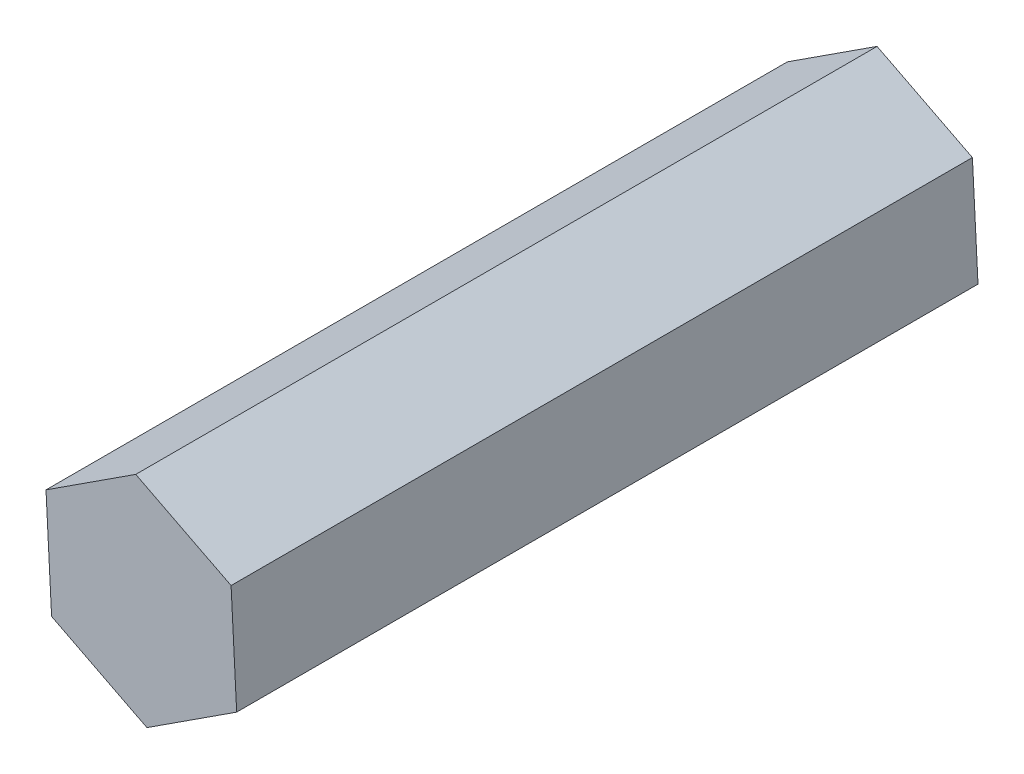
from build123d import *

# Parameters (mm, degrees)
BOSS_EXTRUDE2_DEPTH = 50.8


with BuildPart() as part:
    # Sketch2 → Boss-Extrude2 (new body)
    with BuildSketch(Plane.XY):
        Polygon((-6.532932597, 3.329282958), (-6.149709917, -3.993044111), (0.38322268, -7.322327069), (6.532932597, -3.329282958), (6.149709917, 3.993044111), (-0.38322268, 7.322327069), align=None)
    extrude(amount=BOSS_EXTRUDE2_DEPTH)


solid = part.part
